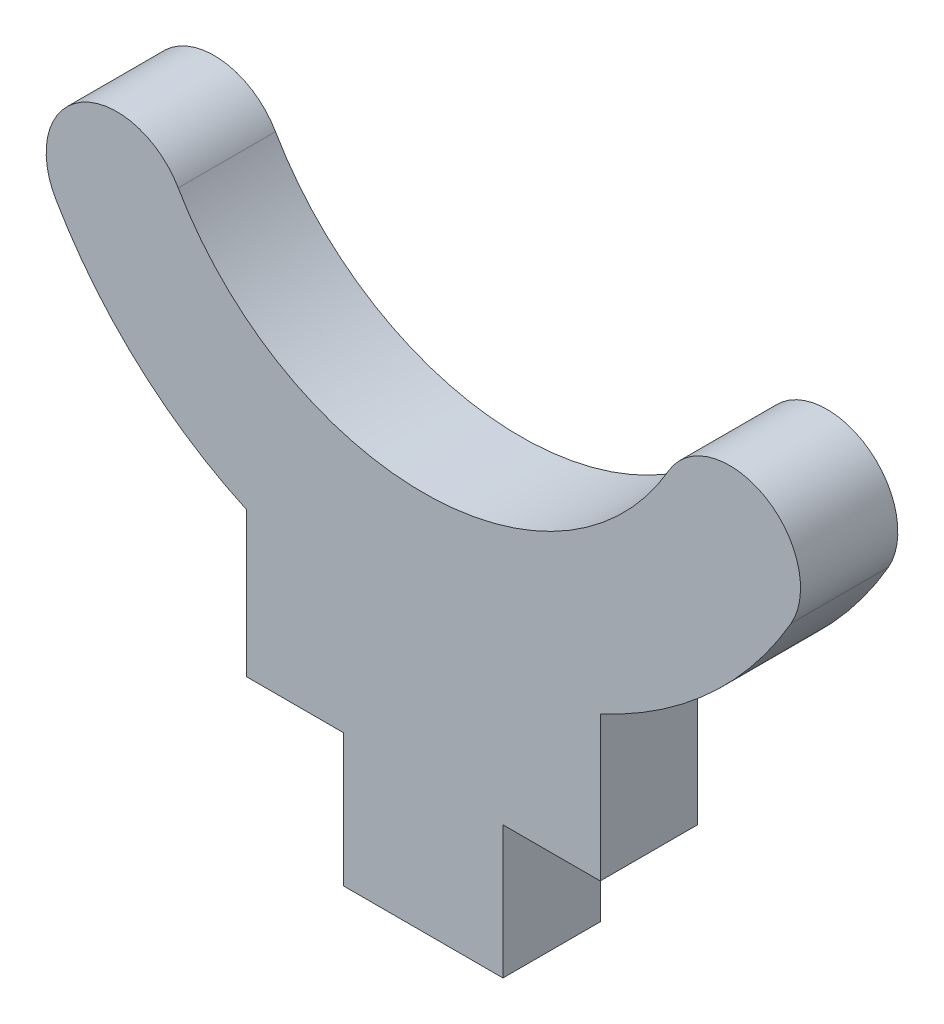
from build123d import *

# Parameters (mm, degrees)
EXTRUDE_1_DEPTH     = 5.5
SKETCH_2_W          = 5.5
SKETCH_2_H          = 7.5
CUT_EXTRUDE_1_DEPTH = 39.432591177


with BuildPart() as part:
    # ｽｹｯﾁ1 → ﾎﾞｽ - 押し出し1 (new body)
    with BuildSketch(Plane.XY):
        with BuildLine():
            Line((-10, 15.682575771), (-10, 0))
            Line((-10, 0), (10, 0))
            Line((10, 0), (10, 15.682575771))
            ThreePointArc((10, 15.682575771), (16.156067067, 19.752281924), (20.784609691, 25.5))
            ThreePointArc((20.784609691, 25.5), (19.320508076, 30.964101615), (13.856406461, 29.5))
            ThreePointArc((13.856406461, 29.5), (0, 21.5), (-13.856406461, 29.5))
            ThreePointArc((-13.856406461, 29.5), (-19.320508076, 30.964101615), (-20.784609691, 25.5))
            ThreePointArc((-20.784609691, 25.5), (-16.156067067, 19.752281924), (-10, 15.682575771))
        make_face()
    extrude(amount=EXTRUDE_1_DEPTH)

    # ｽｹｯﾁ2 → ｶｯﾄ - 押し出し1 (cut, through all)
    with BuildSketch(Plane.XY.offset(5.5)):
        with Locations((7.25, 3.75)):
            Rectangle(SKETCH_2_W, SKETCH_2_H)
        with Locations((-7.25, 3.75)):
            Rectangle(SKETCH_2_W, SKETCH_2_H)
    extrude(amount=-CUT_EXTRUDE_1_DEPTH, mode=Mode.SUBTRACT)


solid = part.part
